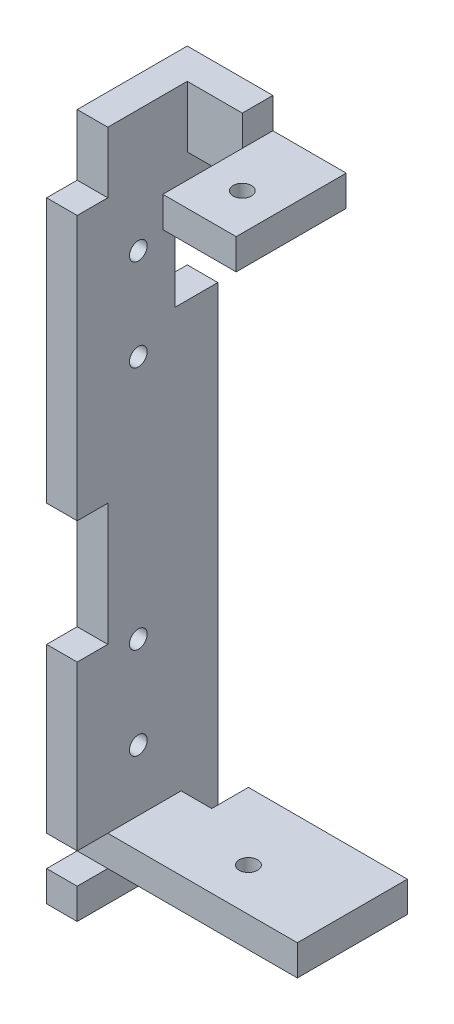
from build123d import *

# Parameters (mm, degrees)
EXTRUDE_1_DEPTH      = 23
SKETCH_2_W           = 5
SKETCH_2_H           = 20
CUT_EXTRUDE_1_DEPTH  = 5
SKETCH_3_R           = 1.5
CUT_EXTRUDE_2_DEPTH  = 106.470477522
SKETCH_5_W           = 70.883972197
SKETCH_5_H           = 5
CUT_EXTRUDE_3_DEPTH  = 5
SKETCH_6_W           = 26
SKETCH_6_H           = 5
EXTRUDE_2_DEPTH      = 23
CUT_EXTRUDE_4_REACH  = 112.223
SKETCH_7_W           = 21
SKETCH_7_H           = 14
SKETCH_9_W           = 42.093612699
SKETCH_9_H           = 5
CUT_EXTRUDE_6_DEPTH  = 5
CUT_EXTRUDE_7_REACH  = 103.079
SKETCH_10_W          = 7
SKETCH_10_H          = 13
SKETCH_12_W          = 12
SKETCH_12_H          = 5
EXTRUDE_4_DEPTH      = 14
EXTRUDE_5_DEPTH      = 5
CUT_EXTRUDE_8_REACH  = 107.632
SKETCH_14_R          = 1.45
SKETCH_15_W          = 5
SKETCH_15_H          = 5
CUT_EXTRUDE_9_DEPTH  = 6
CUT_EXTRUDE_5_REACH  = 112.223
SKETCH_8_R           = 1.5
SKETCH_16_W          = 9
SKETCH_16_H          = 10
EXTRUDE_6_DEPTH      = 5
SKETCH_17_W          = 9
SKETCH_17_H          = 10
CUT_EXTRUDE_10_DEPTH = 5


with BuildPart() as part:
    # 草圖1 → 填料-伸長1 (new body)
    with BuildSketch(Plane.XY):
        Polygon((-6.606934821, -8.392345722), (-6.606934821, -13.392345722), (-11.606934821, -13.392345722), (-11.606934821, 91.607654278), (-6.606934821, 91.607654278), (-6.606934821, 87.03530479), (-6.606934821, 81.216936273), (-6.606934821, -3.392345722), (24.393065179, -3.392345722), (24.393065179, -8.392345722), align=None)
    extrude(amount=EXTRUDE_1_DEPTH)

    # 草圖2 → 除料-伸長1 (cut)
    with BuildSketch(Plane(origin=(0, 0, 23), x_dir=(-1, 0, 0), z_dir=(0, 0, -1))):
        with Locations((9.106934821, 33.357654278)):
            Rectangle(SKETCH_2_W, SKETCH_2_H)
    extrude(amount=CUT_EXTRUDE_1_DEPTH, mode=Mode.SUBTRACT)

    # 草圖3 → 除料-伸長2 (cut, through all)
    with BuildSketch(Plane.XZ.offset(8.392345722)):
        with Locations((9.393065179, 11)):
            Circle(SKETCH_3_R)
    extrude(amount=-CUT_EXTRUDE_2_DEPTH, mode=Mode.SUBTRACT)

    # 草圖5 → 除料-伸長3 (cut)
    with BuildSketch(Plane.XY.offset(23)):
        with Locations((-11.04892092, -5.892345722)):
            Rectangle(SKETCH_5_W, SKETCH_5_H)
    extrude(amount=-CUT_EXTRUDE_3_DEPTH, mode=Mode.SUBTRACT)

    # 草圖6 → 填料-伸長2 (add)
    with BuildSketch(Plane(origin=(0, 0, 0), x_dir=(-1, 0, 0), z_dir=(0, 0, -1))):
        with Locations((-1.393065179, 89.107654278)):
            Rectangle(SKETCH_6_W, SKETCH_6_H)
    extrude(amount=-EXTRUDE_2_DEPTH)

    # 草圖7 → 除料-伸長4 (cut, up to next)
    with BuildSketch(Plane(origin=(0, 91.607654278, 0), x_dir=(1, 0, 0), z_dir=(0, 1, 0)), mode=Mode.PRIVATE) as cut_extrude_4_sk1:
        with Locations((3.893065179, -7)):
            Rectangle(SKETCH_7_W, SKETCH_7_H)
    cut_extrude_4_tool1 = extrude(cut_extrude_4_sk1.sketch, amount=-CUT_EXTRUDE_4_REACH, mode=Mode.PRIVATE) & part.part
    add(cut_extrude_4_tool1.solids().sort_by_distance((3.893065, 91.607654, 7))[0], mode=Mode.SUBTRACT)

    # 草圖9 → 除料-伸長6 (cut)
    with BuildSketch(Plane.XY.offset(23)):
        with Locations((-6.653741171, 89.107654278)):
            Rectangle(SKETCH_9_W, SKETCH_9_H)
    extrude(amount=-CUT_EXTRUDE_6_DEPTH, mode=Mode.SUBTRACT)

    # 草圖10 → 除料-伸長7 (cut, up to next)
    with BuildSketch(Plane.ZY.offset(11.606934821), mode=Mode.PRIVATE) as cut_extrude_7_sk1:
        with Locations((3.5, 72.107654278)):
            Rectangle(SKETCH_10_W, SKETCH_10_H)
    cut_extrude_7_tool1 = extrude(cut_extrude_7_sk1.sketch, amount=-CUT_EXTRUDE_7_REACH, mode=Mode.PRIVATE) & part.part
    add(cut_extrude_7_tool1.solids().sort_by_distance((-11.606935, 72.107654, 3.5))[0], mode=Mode.SUBTRACT)

    # 草圖12 → 填料-伸長4 (add)
    with BuildSketch(Plane(origin=(0, 0, 14), x_dir=(-1, 0, 0), z_dir=(0, 0, -1))):
        with Locations((-8.393065179, 89.107654278)):
            Rectangle(SKETCH_12_W, SKETCH_12_H)
    extrude(amount=EXTRUDE_4_DEPTH)

    # 草圖13 → 填料-伸長5 (add)
    with BuildSketch(Plane(origin=(0, 91.607654278, 0), x_dir=(1, 0, 0), z_dir=(0, 1, 0))):
        Polygon((2.393065179, -14), (-6.606934821, -14), (-6.606934821, 0), (-11.606934821, 0), (-11.606934821, -5), (-11.606934821, -18), (2.393065179, -18), align=None)
    extrude(amount=EXTRUDE_5_DEPTH)

    # 草圖14 → 除料-伸長8 (cut, up to next)
    with BuildSketch(Plane.ZY.offset(11.606934821), mode=Mode.PRIVATE) as cut_extrude_8_sk1:
        with Locations(Location((13, 76.607654278, 0), (0, 0, 270))):
            Circle(SKETCH_14_R)
    cut_extrude_8_tool1 = extrude(cut_extrude_8_sk1.sketch, amount=-CUT_EXTRUDE_8_REACH, mode=Mode.PRIVATE) & part.part
    # 草圖14 → 除料-伸長8 (cut, up to next)
    with BuildSketch(Plane.ZY.offset(11.606934821), mode=Mode.PRIVATE) as cut_extrude_8_sk2:
        with Locations(Location((13, 6.607654278, 0), (0, 0, 270))):
            Circle(SKETCH_14_R)
    cut_extrude_8_tool2 = extrude(cut_extrude_8_sk2.sketch, amount=-CUT_EXTRUDE_8_REACH, mode=Mode.PRIVATE) & part.part
    # 草圖14 → 除料-伸長8 (cut, up to next)
    with BuildSketch(Plane.ZY.offset(11.606934821), mode=Mode.PRIVATE) as cut_extrude_8_sk3:
        with Locations(Location((13, 61.607654278, 0), (0, 0, 270))):
            Circle(SKETCH_14_R)
    cut_extrude_8_tool3 = extrude(cut_extrude_8_sk3.sketch, amount=-CUT_EXTRUDE_8_REACH, mode=Mode.PRIVATE) & part.part
    # 草圖14 → 除料-伸長8 (cut, up to next)
    with BuildSketch(Plane.ZY.offset(11.606934821), mode=Mode.PRIVATE) as cut_extrude_8_sk4:
        with Locations(Location((13, 21.607654278, 0), (0, 0, 270))):
            Circle(SKETCH_14_R)
    cut_extrude_8_tool4 = extrude(cut_extrude_8_sk4.sketch, amount=-CUT_EXTRUDE_8_REACH, mode=Mode.PRIVATE) & part.part
    add(cut_extrude_8_tool1.solids().sort_by_distance((-11.606935, 76.607654, 13))[0], mode=Mode.SUBTRACT)
    add(cut_extrude_8_tool2.solids().sort_by_distance((-11.606935, 6.607654, 13))[0], mode=Mode.SUBTRACT)
    add(cut_extrude_8_tool3.solids().sort_by_distance((-11.606935, 61.607654, 13))[0], mode=Mode.SUBTRACT)
    add(cut_extrude_8_tool4.solids().sort_by_distance((-11.606935, 21.607654, 13))[0], mode=Mode.SUBTRACT)

    # 草圖15 → 除料-伸長9 (cut)
    with BuildSketch(Plane(origin=(0, 0, 0), x_dir=(-1, 0, 0), z_dir=(0, 0, -1))):
        with Locations((4.106934821, -5.892345722)):
            Rectangle(SKETCH_15_W, SKETCH_15_H)
    extrude(amount=-CUT_EXTRUDE_9_DEPTH, mode=Mode.SUBTRACT)

    # 草圖8 → 除料-伸長5 (cut, up to next)
    with BuildSketch(Plane(origin=(0, 91.607654278, 0), x_dir=(1, 0, 0), z_dir=(0, 1, 0)), mode=Mode.PRIVATE) as cut_extrude_5_sk1:
        with Locations(Location((8.393065179, -11, 0), (0, 0, 270))):
            Circle(SKETCH_8_R)
    cut_extrude_5_tool1 = extrude(cut_extrude_5_sk1.sketch, amount=-CUT_EXTRUDE_5_REACH, mode=Mode.PRIVATE) & part.part
    add(cut_extrude_5_tool1.solids().sort_by_distance((8.393065, 91.607654, 11))[0], mode=Mode.SUBTRACT)

    # 草圖16 → 填料-伸長6 (add)
    with BuildSketch(Plane(origin=(0, 0, 0), x_dir=(-1, 0, 0), z_dir=(0, 0, -1))):
        with Locations((2.106934821, 91.607654278)):
            Rectangle(SKETCH_16_W, SKETCH_16_H)
    extrude(amount=-EXTRUDE_6_DEPTH)

    # 草圖17 → 除料-伸長10 (cut)
    with BuildSketch(Plane.XY.offset(18)):
        with Locations((-2.106934821, 91.607654278)):
            Rectangle(SKETCH_17_W, SKETCH_17_H)
    extrude(amount=-CUT_EXTRUDE_10_DEPTH, mode=Mode.SUBTRACT)


solid = part.part
